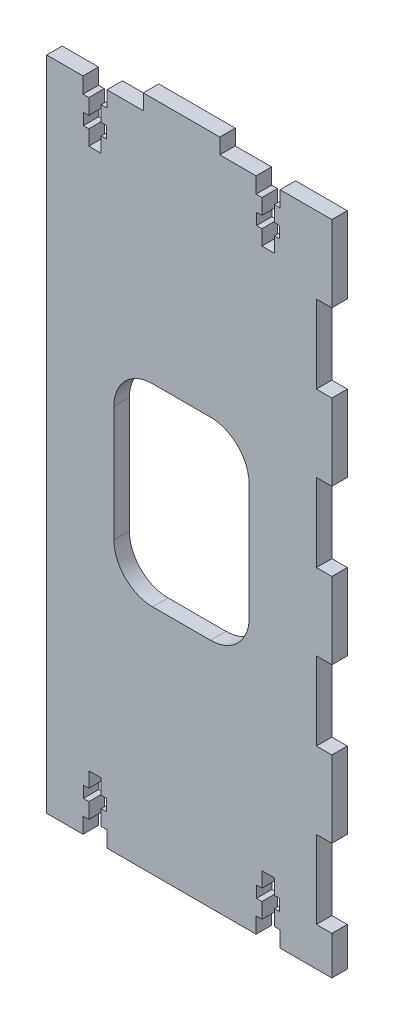
from build123d import *

# Parameters (mm, degrees)
BOSS_EXTRUDE1_DEPTH = 4
CUT_EXTRUDE1_DEPTH  = 96.681816454
SKETCH4_W           = 4
SKETCH4_H           = 19.8
BOSS_EXTRUDE2_DEPTH = 4
SKETCH5_W           = 4
SKETCH5_H           = 10
BOSS_EXTRUDE3_DEPTH = 4
CUT_EXTRUDE2_DEPTH  = 98.212190594


with BuildPart() as part:
    # Sketch1 → Boss-Extrude1 (new body)
    with BuildSketch(Plane.XY):
        Polygon((-9.9, 85), (-9.9, 89), (9.9, 89), (9.9, 85), (34.9, 85), (34.9, -85), (-34.9, -85), (-34.9, 85), align=None)
    extrude(amount=BOSS_EXTRUDE1_DEPTH)

    # Sketch3 → Cut-Extrude1 (cut, through all)
    with BuildSketch(Plane(origin=(0, 0, 0), x_dir=(-1, 0, 0), z_dir=(0, 0, -1))):
        Polygon((25.5, 85), (25.5, 80.9), (24, 80.9), (24, 76.9), (25.4, 76.9), (25.4, 73.9), (24, 73.9), (24, 70), (20.8, 70), (20.8, 73.9), (19.4, 73.9), (19.4, 76.9), (20.8, 76.9), (20.8, 80.9), (19.3, 80.9), (19.3, 85), align=None)
        Polygon((-19.3, 85), (-19.3, 80.9), (-20.8, 80.9), (-20.8, 76.9), (-19.4, 76.9), (-19.4, 73.9), (-20.8, 73.9), (-20.8, 70), (-24, 70), (-24, 73.9), (-25.4, 73.9), (-25.4, 76.9), (-24, 76.9), (-24, 80.9), (-25.5, 80.9), (-25.5, 85), align=None)
        Polygon((-25.5, -85), (-25.5, -80.9), (-24, -80.9), (-24, -76.9), (-25.4, -76.9), (-25.4, -73.9), (-24, -73.9), (-24, -70), (-20.8, -70), (-20.8, -73.9), (-19.4, -73.9), (-19.4, -76.9), (-20.8, -76.9), (-20.8, -80.9), (-19.3, -80.9), (-19.3, -85), align=None)
        Polygon((19.3, -85), (19.3, -80.9), (20.8, -80.9), (20.8, -76.9), (19.4, -76.9), (19.4, -73.9), (20.8, -73.9), (20.8, -70), (24, -70), (24, -73.9), (25.4, -73.9), (25.4, -76.9), (24, -76.9), (24, -80.9), (25.5, -80.9), (25.5, -85), align=None)
    extrude(amount=-CUT_EXTRUDE1_DEPTH, mode=Mode.SUBTRACT)

    # Sketch4 → Boss-Extrude2 (add)
    with BuildSketch(Plane(origin=(0, 0, 0), x_dir=(-1, 0, 0), z_dir=(0, 0, -1))):
        with Locations((-36.9, 35.1)):
            Rectangle(SKETCH4_W, SKETCH4_H)
        with Locations((-36.9, 75.1)):
            Rectangle(SKETCH4_W, SKETCH4_H)
        with Locations((-36.9, -4.9)):
            Rectangle(SKETCH4_W, SKETCH4_H)
        with Locations((-36.9, -44.9)):
            Rectangle(SKETCH4_W, SKETCH4_H)
    extrude(amount=-BOSS_EXTRUDE2_DEPTH)

    # Sketch5 → Boss-Extrude3 (add)
    with BuildSketch(Plane(origin=(0, 0, 0), x_dir=(-1, 0, 0), z_dir=(0, 0, -1))):
        with Locations((-36.9, -80)):
            Rectangle(SKETCH5_W, SKETCH5_H)
    extrude(amount=-BOSS_EXTRUDE3_DEPTH)

    # Sketch6 → Cut-Extrude2 (cut, through all)
    with BuildSketch(Plane(origin=(0, 0, 0), x_dir=(-1, 0, 0), z_dir=(0, 0, -1))):
        with BuildLine():
            Line((-7.5, 25), (7.5, 25))
            ThreePointArc((7.5, 25), (14.571067812, 22.071067812), (17.5, 15))
            Line((17.5, 15), (17.5, -15))
            ThreePointArc((17.5, -15), (14.571067812, -22.071067812), (7.5, -25))
            Line((7.5, -25), (-7.5, -25))
            ThreePointArc((-7.5, -25), (-14.571067812, -22.071067812), (-17.5, -15))
            Line((-17.5, -15), (-17.5, 15))
            ThreePointArc((-17.5, 15), (-14.571067812, 22.071067812), (-7.5, 25))
        make_face()
    extrude(amount=-CUT_EXTRUDE2_DEPTH, mode=Mode.SUBTRACT)


solid = part.part
